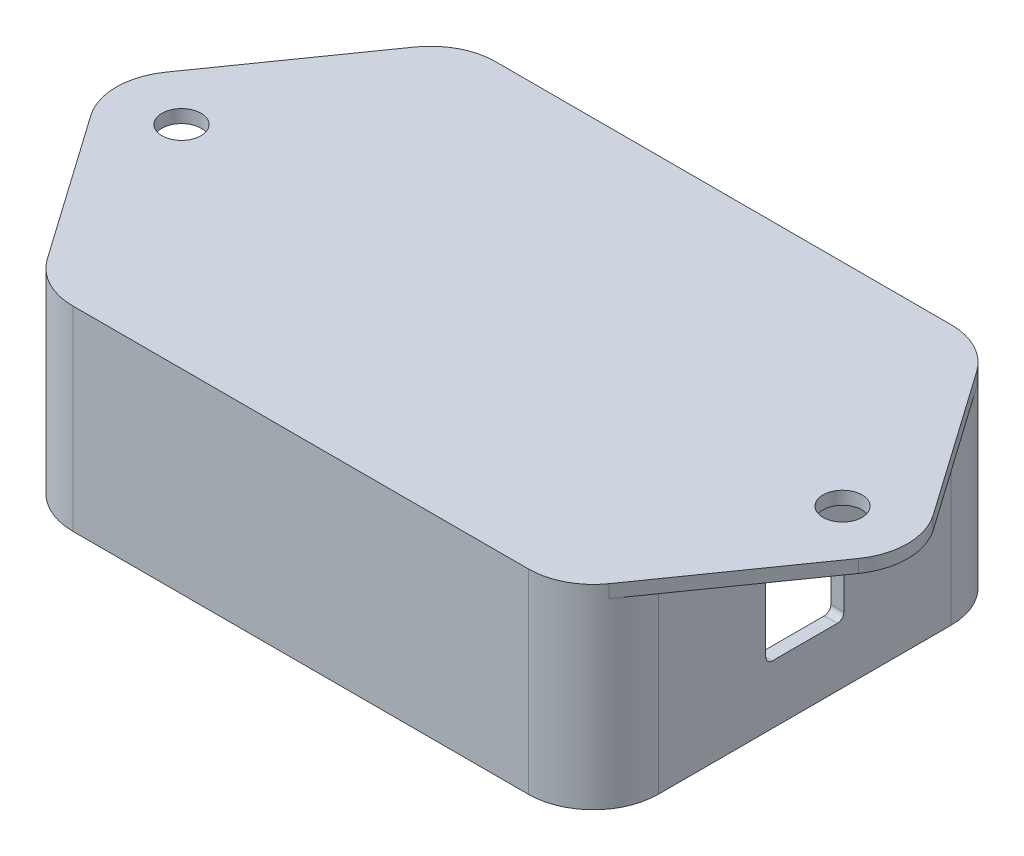
from build123d import *

# Parameters (mm, degrees)
BOSS_EXTRU_1_DEPTH                  = 2
BOSS_EXTRU_2_START                  = 28
BOSS_EXTRU_2_DEPTH                  = 28
ENL_V_MAT_EXTRU_1_DEPTH             = 28
BOSS_EXTRU_3_DEPTH                  = 22
BOSS_EXTRU_4_DEPTH                  = 6
BOSS_EXTRU_5_DEPTH                  = 22
BOSS_EXTRU_6_DEPTH                  = 6
BOSS_EXTRU_7_DEPTH                  = 22
BOSS_EXTRU_8_DEPTH                  = 6
BOSS_EXTRU_9_DEPTH                  = 22
BOSS_EXTRU_10_DEPTH                 = 6
ENL_V_MAT_EXTRU_2_REACH             = 116.632
ESQUISSE12_W                        = 12
ESQUISSE12_H                        = 12
ESQUISSE13_W                        = 12
ESQUISSE13_H                        = 12
ENL_V_MAT_EXTRU_3_DEPTH             = 115.63237734
D_POUILLE1_ANGLE                    = 1
DIAM_TRE_DU_PER_AGE_6_0_6_1_D       = 6
DIAM_TRE_DU_PER_AGE_6_0_6_1_DEPTH   = 30
DIAM_TRE_DU_PER_AGE_1_8_1_8_1_D     = 1.8
DIAM_TRE_DU_PER_AGE_1_8_1_8_1_DEPTH = 7
PER_AGE1_D                          = 2.65
PER_AGE1_DEPTH                      = 8
CONG_1_R                            = 1
CONG_2_R                            = 10


with BuildPart() as part:
    # Esquisse1 → Boss.-Extru.1 (new body)
    with BuildSketch(Plane.XZ.offset(-7.6)):
        with BuildLine():
            Line((63.019312785, 0), (43.183766285, 28.246822547))
            ThreePointArc((43.183766285, 28.246822547), (39.611495122, 31.373224484), (35, 32.5))
            Line((35, 32.5), (-35, 32.5))
            ThreePointArc((-35, 32.5), (-39.611495122, 31.373224484), (-43.183766285, 28.246822547))
            Line((-43.183766285, 28.246822547), (-63.019312785, 0))
            Line((-63.019312785, 0), (-43.183766285, -28.246822547))
            ThreePointArc((-43.183766285, -28.246822547), (-39.611495122, -31.373224484), (-35, -32.5))
            Line((-35, -32.5), (35, -32.5))
            ThreePointArc((35, -32.5), (39.611495122, -31.373224484), (43.183766285, -28.246822547))
            Line((43.183766285, -28.246822547), (63.019312785, 0))
        make_face()
    extrude(amount=-BOSS_EXTRU_1_DEPTH)

    # Esquisse2 → Boss.-Extru.2 (add)
    with BuildSketch(Plane.XZ.offset(-7.6).offset(BOSS_EXTRU_2_START)):
        with BuildLine():
            Line((-45, -22.5), (-45, 22.5))
            ThreePointArc((-45, 22.5), (-42.071067812, 29.571067812), (-35, 32.5))
            Line((-35, 32.5), (35, 32.5))
            ThreePointArc((35, 32.5), (42.071067812, 29.571067812), (45, 22.5))
            Line((45, 22.5), (45, -22.5))
            ThreePointArc((45, -22.5), (42.071067812, -29.571067812), (35, -32.5))
            Line((35, -32.5), (-35, -32.5))
            ThreePointArc((-35, -32.5), (-42.071067812, -29.571067812), (-45, -22.5))
        make_face()
    extrude(amount=-BOSS_EXTRU_2_DEPTH)

    # Esquisse3 → Enlèv. mat.-Extru.1 (cut)
    with BuildSketch(Plane.XZ.offset(20.4)):
        with BuildLine():
            Line((43, -22.5), (43, 22.5))
            ThreePointArc((43, 22.5), (40.656854249, 28.156854249), (35, 30.5))
            Line((35, 30.5), (-35, 30.5))
            ThreePointArc((-35, 30.5), (-40.656854249, 28.156854249), (-43, 22.5))
            Line((-43, 22.5), (-43, -22.5))
            ThreePointArc((-43, -22.5), (-40.656854249, -28.156854249), (-35, -30.5))
            Line((-35, -30.5), (35, -30.5))
            ThreePointArc((35, -30.5), (40.656854249, -28.156854249), (43, -22.5))
        make_face()
    extrude(amount=-ENL_V_MAT_EXTRU_1_DEPTH, mode=Mode.SUBTRACT)

    # Esquisse4 → Boss.-Extru.3 (add)
    with BuildSketch(Plane.XZ.offset(-7.6)):
        with BuildLine():
            Line((42.708099244, -15.5), (43, -15.5))
            Line((43, -15.5), (43, -18.5))
            Line((43, -18.5), (42.708099244, -18.5))
            ThreePointArc((42.708099244, -18.5), (35, -17), (42.708099244, -15.5))
        make_face()
    extrude(amount=BOSS_EXTRU_3_DEPTH)

    # Esquisse5 → Boss.-Extru.4 (add)
    with BuildSketch(Plane.XZ.offset(-7.6)):
        with BuildLine():
            Line((34.492820127, -19.515715167), (35.346896814, -18.629367089))
            ThreePointArc((35.346896814, -18.629367089), (36.224495368, -19.880377412), (37.507179873, -20.710995563))
            Line((37.507179873, -20.710995563), (36.653103186, -21.597343641))
            ThreePointArc((36.653103186, -21.597343641), (30.224495368, -26.107088143), (34.492820127, -19.515715167))
        make_face()
    extrude(amount=BOSS_EXTRU_4_DEPTH)

    # Esquisse6 → Boss.-Extru.5 (add)
    with BuildSketch(Plane.XZ.offset(-7.6)):
        with BuildLine():
            Line((-42.708099244, -18.5), (-43, -18.5))
            Line((-43, -18.5), (-43, -15.5))
            Line((-43, -15.5), (-42.708099244, -15.5))
            ThreePointArc((-42.708099244, -15.5), (-35, -17), (-42.708099244, -18.5))
        make_face()
    extrude(amount=BOSS_EXTRU_5_DEPTH)

    # Esquisse7 → Boss.-Extru.6 (add)
    with BuildSketch(Plane.XZ.offset(-7.6)):
        with BuildLine():
            Line((-36.682682292, -21.438638051), (-37.438638051, -20.682682292))
            ThreePointArc((-37.438638051, -20.682682292), (-36.171572875, -19.828427125), (-35.317317708, -18.561361949))
            Line((-35.317317708, -18.561361949), (-34.561361949, -19.317317708))
            ThreePointArc((-34.561361949, -19.317317708), (-30.171572875, -25.828427125), (-36.682682292, -21.438638051))
        make_face()
    extrude(amount=BOSS_EXTRU_6_DEPTH)

    # Esquisse8 → Boss.-Extru.7 (add)
    with BuildSketch(Plane.XZ.offset(-7.6)):
        with BuildLine():
            Line((42.708099244, 18.5), (43, 18.5))
            Line((43, 18.5), (43, 15.5))
            Line((43, 15.5), (42.708099244, 15.5))
            ThreePointArc((42.708099244, 15.5), (35, 17), (42.708099244, 18.5))
        make_face()
    extrude(amount=BOSS_EXTRU_7_DEPTH)

    # Esquisse9 → Boss.-Extru.8 (add)
    with BuildSketch(Plane.XZ.offset(-7.6)):
        with BuildLine():
            Line((36.682682292, 21.438638051), (37.438638051, 20.682682292))
            ThreePointArc((37.438638051, 20.682682292), (36.171572875, 19.828427125), (35.317317708, 18.561361949))
            Line((35.317317708, 18.561361949), (34.561361949, 19.317317708))
            ThreePointArc((34.561361949, 19.317317708), (30.171572875, 25.828427125), (36.682682292, 21.438638051))
        make_face()
    extrude(amount=BOSS_EXTRU_8_DEPTH)

    # Esquisse10 → Boss.-Extru.9 (add)
    with BuildSketch(Plane.XZ.offset(-7.6)):
        with BuildLine():
            Line((-42.708099244, 15.5), (-43, 15.5))
            Line((-43, 15.5), (-43, 18.5))
            Line((-43, 18.5), (-42.708099244, 18.5))
            ThreePointArc((-42.708099244, 18.5), (-35, 17), (-42.708099244, 15.5))
        make_face()
    extrude(amount=BOSS_EXTRU_9_DEPTH)

    # Esquisse11 → Boss.-Extru.10 (add)
    with BuildSketch(Plane.XZ.offset(-7.6)):
        with BuildLine():
            Line((-34.561361949, 19.317317708), (-35.317317708, 18.561361949))
            ThreePointArc((-35.317317708, 18.561361949), (-36.171572875, 19.828427125), (-37.438638051, 20.682682292))
            Line((-37.438638051, 20.682682292), (-36.682682292, 21.438638051))
            ThreePointArc((-36.682682292, 21.438638051), (-30.171572875, 25.828427125), (-34.561361949, 19.317317708))
        make_face()
    extrude(amount=BOSS_EXTRU_10_DEPTH)

    # Esquisse12 → Enlèv. mat.-Extru.2 (cut, up to next)
    with BuildSketch(Plane.ZY.offset(45), mode=Mode.PRIVATE) as enl_v_mat_extru_2_sk1:
        with Locations((0, -5.4)):
            Rectangle(ESQUISSE12_W, ESQUISSE12_H)
    enl_v_mat_extru_2_tool1 = extrude(enl_v_mat_extru_2_sk1.sketch, amount=-ENL_V_MAT_EXTRU_2_REACH, mode=Mode.PRIVATE) & part.part
    add(enl_v_mat_extru_2_tool1.solids().sort_by_distance((-45, -5.4, 0))[0], mode=Mode.SUBTRACT)

    # Esquisse13 → Enlèv. mat.-Extru.3 (cut, through all)
    with BuildSketch(Plane(origin=(45, 0, 0), x_dir=(0, 0, -1), z_dir=(1, 0, 0))):
        with Locations((0, -5.4)):
            Rectangle(ESQUISSE13_W, ESQUISSE13_H)
    extrude(amount=-ENL_V_MAT_EXTRU_3_DEPTH, mode=Mode.SUBTRACT)

    # Dépouille1
    d_pouille1_faces = [part.faces().sort_by_distance(p)[0] for p in [
        (-35, -3.4, 17),
        (35, -3.4, 17),
        (35, -3.4, -17),
        (-35, -3.4, -17),
    ]]
    draft(d_pouille1_faces, Plane(origin=(35, 7.6, -22.5), x_dir=(0, 0, -1), z_dir=(0, -1, 0)), D_POUILLE1_ANGLE)

    # Diamètre du perçage Ø6.0 (6)1
    with Locations(Plane(origin=(0, 9.6, 0), x_dir=(1, 0, 0), z_dir=(0, 1, 0))):
        with Locations((-50.8, 0), (50.8, 0)):
            Hole(DIAM_TRE_DU_PER_AGE_6_0_6_1_D / 2, depth=DIAM_TRE_DU_PER_AGE_6_0_6_1_DEPTH)

    # Diamètre du perçage Ø1.8 (1.8)1
    with Locations(Plane(origin=(0, 1.6, 0), x_dir=(-1, 0, 0), z_dir=(0, -1, 0))):
        with Locations((33, -23), (-33, -23), (-33, 23.22671073), (33, 23)):
            Hole(DIAM_TRE_DU_PER_AGE_1_8_1_8_1_D / 2, depth=DIAM_TRE_DU_PER_AGE_1_8_1_8_1_DEPTH)

    # Perçage1
    with Locations(Plane(origin=(0, -14.4, 0), x_dir=(-1, 0, 0), z_dir=(0, -1, 0))):
        with Locations((-39, 17), (-39, -17), (39, 17), (39, -17)):
            Hole(PER_AGE1_D / 2, depth=PER_AGE1_DEPTH)

    # Congé1
    cong_1_edges = [part.edges().sort_by_distance(p)[0] for p in [
        (-44, -11.4, -6),
        (-44, 0.6, -6),
        (-44, 0.6, 6),
        (-44, -11.4, 6),
        (44, -11.4, -6),
        (44, 0.6, 6),
        (44, 0.6, -6),
        (44, -11.4, 6),
    ]]
    fillet(cong_1_edges, radius=CONG_1_R)

    # Congé2
    cong_2_edges = [part.edges().sort_by_distance(p)[0] for p in [
        (-63.019312785, 8.6, 0),
        (63.019312785, 8.6, 0),
    ]]
    fillet(cong_2_edges, radius=CONG_2_R)


solid = part.part
